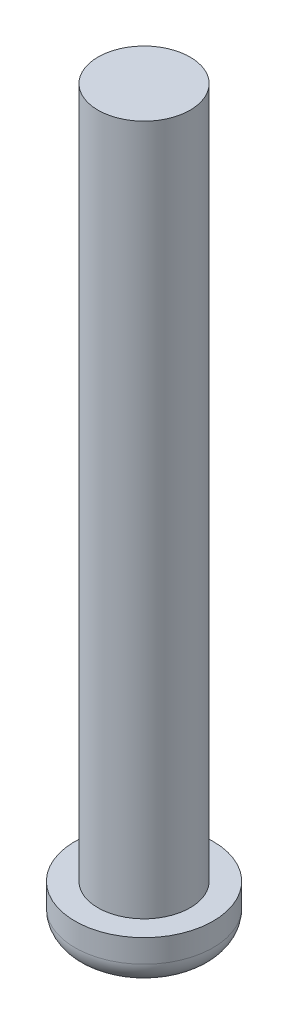
from build123d import *

# Parameters (mm, degrees)
CROQUIS1_R              = 4
SALIENTE_EXTRUIR1_DEPTH = 60
CROQUIS2_R              = 6
SALIENTE_EXTRUIR2_DEPTH = 4
REDONDEO1_R             = 2


with BuildPart() as part:
    # Croquis1 → Saliente-Extruir1 (new body)
    with BuildSketch(Plane(origin=(0, 0, 0), x_dir=(1, 0, 0), z_dir=(0, 1, 0))):
        with Locations(Location((0, 0, 0), (0, 0, 270))):
            Circle(CROQUIS1_R)
    extrude(amount=SALIENTE_EXTRUIR1_DEPTH)

    # Croquis2 → Saliente-Extruir2 (add)
    with BuildSketch(Plane(origin=(0, 0, 0), x_dir=(-1, 0, 0), z_dir=(0, -1, 0))):
        with Locations(Location((0, 0, 0), (0, 0, 90))):
            Circle(CROQUIS2_R)
    extrude(amount=SALIENTE_EXTRUIR2_DEPTH)

    # Redondeo1
    redondeo1_edges = [part.edges().sort_by_distance(p)[0] for p in [
        (0, -4, 6),
    ]]
    fillet(redondeo1_edges, radius=REDONDEO1_R)


solid = part.part
